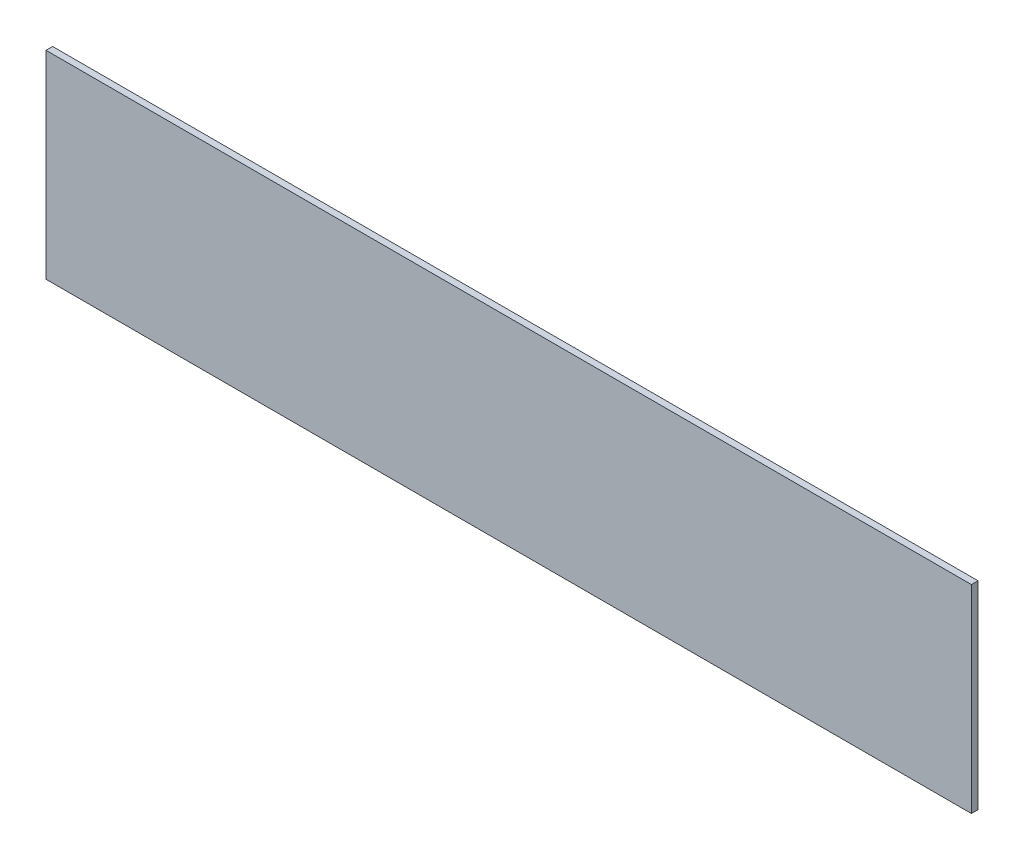
from build123d import *

# Parameters (mm, degrees)
SKETCH1_W           = 280
SKETCH1_H           = 60
BOSS_EXTRUDE1_DEPTH = 2


with BuildPart() as part:
    # Sketch1 → Boss-Extrude1 (new body)
    with BuildSketch(Plane.XY):
        with Locations((-27.703180212, 50.38869258)):
            Rectangle(SKETCH1_W, SKETCH1_H)
    extrude(amount=BOSS_EXTRUDE1_DEPTH)


solid = part.part
